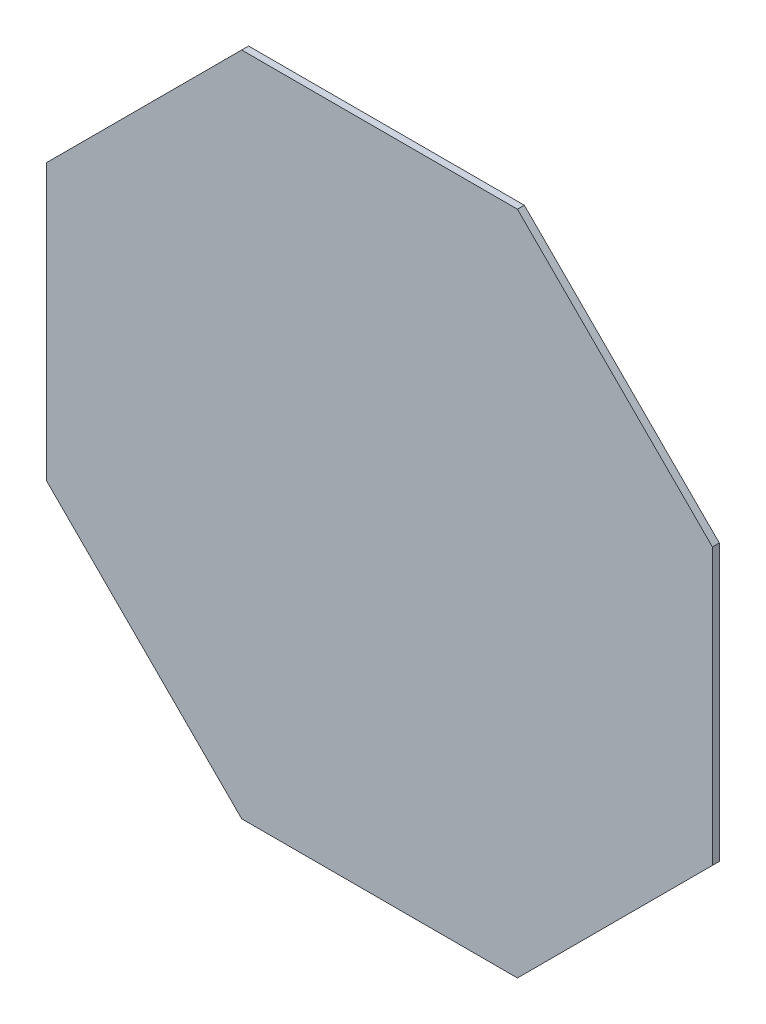
from build123d import *

# Parameters (mm, degrees)
BOSS_EXTRUDE1_DEPTH = 3


with BuildPart() as part:
    # Sketch1 → Boss-Extrude1 (new body)
    with BuildSketch(Plane(origin=(0, 0, 0), x_dir=(0, 1, 0), z_dir=(0, 0, 1))):
        Polygon((-60, 144.852813742), (-144.852813742, 60), (-144.852813742, -60), (-60, -144.852813742), (60, -144.852813742), (144.852813742, -60), (144.852813742, 60), (60, 144.852813742), align=None)
    extrude(amount=BOSS_EXTRUDE1_DEPTH)


solid = part.part
